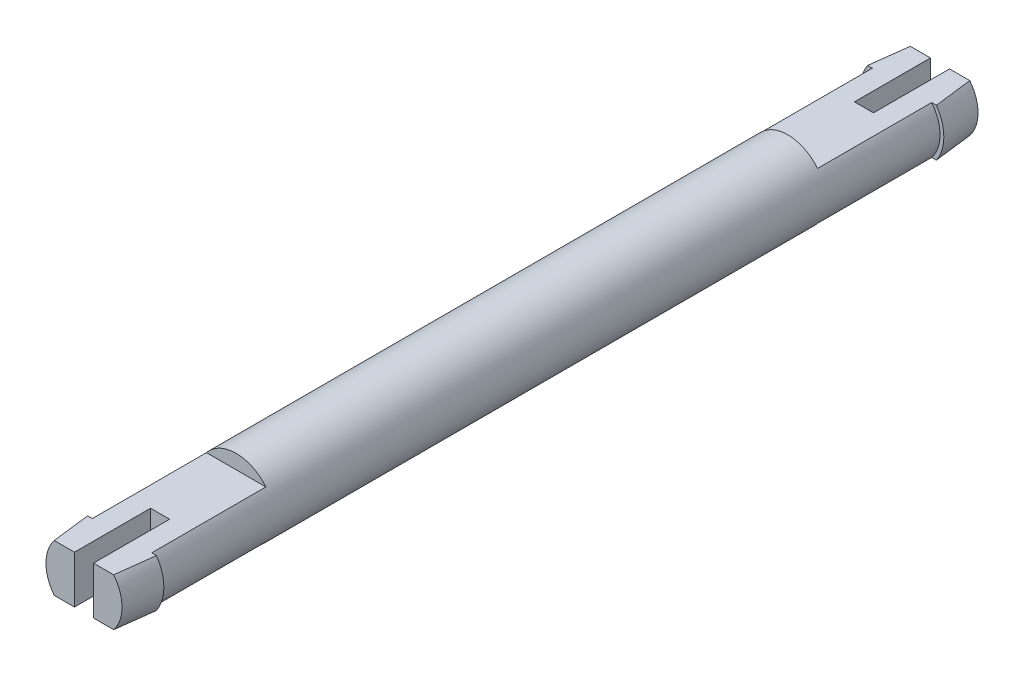
from build123d import *

# Parameters (mm, degrees)
SKETCH_1_R          = 2
EXTRUDE_1_DEPTH     = 45
SKETCH_3_W          = 4.2
SKETCH_3_H          = 1
CUT_EXTRUDE_1_DEPTH = 8
CUT_EXTRUDE_2_REACH = 47.171
SKETCH_4_W          = 1
SKETCH_4_H          = 4
SKETCH_6_W          = 4.2
SKETCH_6_H          = 1
CUT_EXTRUDE_3_DEPTH = 8
SKETCH_7_W          = 1
SKETCH_7_H          = 4
CUT_EXTRUDE_4_DEPTH = 46.170814693


with BuildPart() as part:
    # 草图1 → 凸台-拉伸1 (new body)
    with BuildSketch(Plane.XY):
        Circle(SKETCH_1_R)
    extrude(amount=-EXTRUDE_1_DEPTH)

    # 草图2 → 旋转1 (revolve)
    with BuildSketch(Plane(origin=(0, 0, 0), x_dir=(1, 0, 0), z_dir=(0, 1, 0))):
        Polygon((0, 0), (0, 2), (2.2, 2), (2, 0), align=None)
    revolve(axis=Axis((0, 0, 0), (0, 0, -1)))

    # 草图3 → 切除-拉伸1 (cut)
    with BuildSketch(Plane.XY):
        with Locations((0, 1.75)):
            Rectangle(SKETCH_3_W, SKETCH_3_H)
        with Locations((0, -1.75)):
            Rectangle(SKETCH_3_W, SKETCH_3_H)
    extrude(amount=-CUT_EXTRUDE_1_DEPTH, mode=Mode.SUBTRACT)

    # 草图4 → 切除-拉伸2 (cut, up to next)
    with BuildSketch(Plane.XZ.offset(1.25), mode=Mode.PRIVATE) as cut_extrude_2_sk1:
        with Locations((0, -2)):
            Rectangle(SKETCH_4_W, SKETCH_4_H)
    cut_extrude_2_tool1 = extrude(cut_extrude_2_sk1.sketch, amount=-CUT_EXTRUDE_2_REACH, mode=Mode.PRIVATE) & part.part
    add(cut_extrude_2_tool1.solids().sort_by_distance((0, -1.25, -2))[0], mode=Mode.SUBTRACT)

    # 草图5 → 旋转2 (revolve)
    with BuildSketch(Plane(origin=(0, 0, 0), x_dir=(1, 0, 0), z_dir=(0, 1, 0))):
        Polygon((0, 45), (0, 43), (2.2, 43), (2, 45), align=None)
    revolve(axis=Axis((0, 0, -58.137689197), (0, 0, -1)))

    # 草图6 → 切除-拉伸3 (cut)
    with BuildSketch(Plane(origin=(0, 0, -45), x_dir=(-1, 0, 0), z_dir=(0, 0, -1))):
        with Locations((0, 1.75)):
            Rectangle(SKETCH_6_W, SKETCH_6_H)
        with Locations((0, -1.75)):
            Rectangle(SKETCH_6_W, SKETCH_6_H)
    extrude(amount=-CUT_EXTRUDE_3_DEPTH, mode=Mode.SUBTRACT)

    # 草图7 → 切除-拉伸4 (cut, through all)
    with BuildSketch(Plane(origin=(0, 1.25, 0), x_dir=(1, 0, 0), z_dir=(0, 1, 0))):
        with Locations((0, 43)):
            Rectangle(SKETCH_7_W, SKETCH_7_H)
    extrude(amount=-CUT_EXTRUDE_4_DEPTH, mode=Mode.SUBTRACT)


solid = part.part
